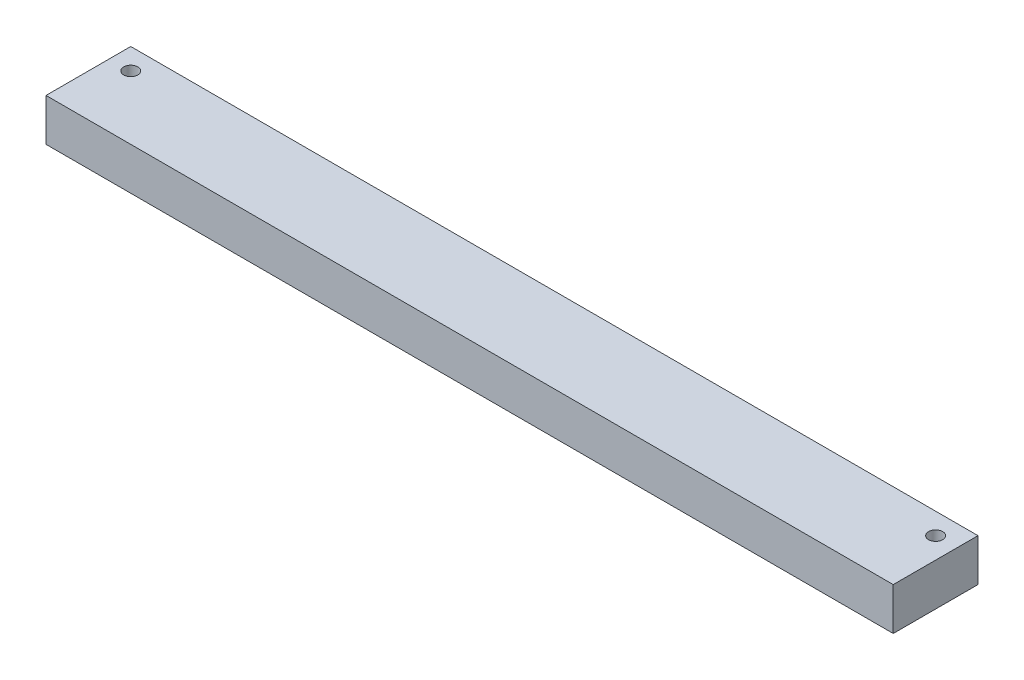
from build123d import *

# Parameters (mm, degrees)
SKETCH1_W           = 59.98
SKETCH1_H           = 6
SKETCH1_R           = 0.5
BOSS_EXTRUDE1_DEPTH = 3


with BuildPart() as part:
    # Sketch1 → Boss-Extrude1 (new body)
    with BuildSketch(Plane(origin=(0, 0, 0), x_dir=(1, 0, 0), z_dir=(0, 1, 0))):
        Rectangle(SKETCH1_W, SKETCH1_H)
        with Locations(Location((-28.490933624, 1.500933624, 0), (0, 0, 270))):
            Circle(SKETCH1_R, mode=Mode.SUBTRACT)
        with Locations(Location((28.490933624, 1.500933624, 0), (0, 0, 90))):
            Circle(SKETCH1_R, mode=Mode.SUBTRACT)
    extrude(amount=BOSS_EXTRUDE1_DEPTH)


solid = part.part
